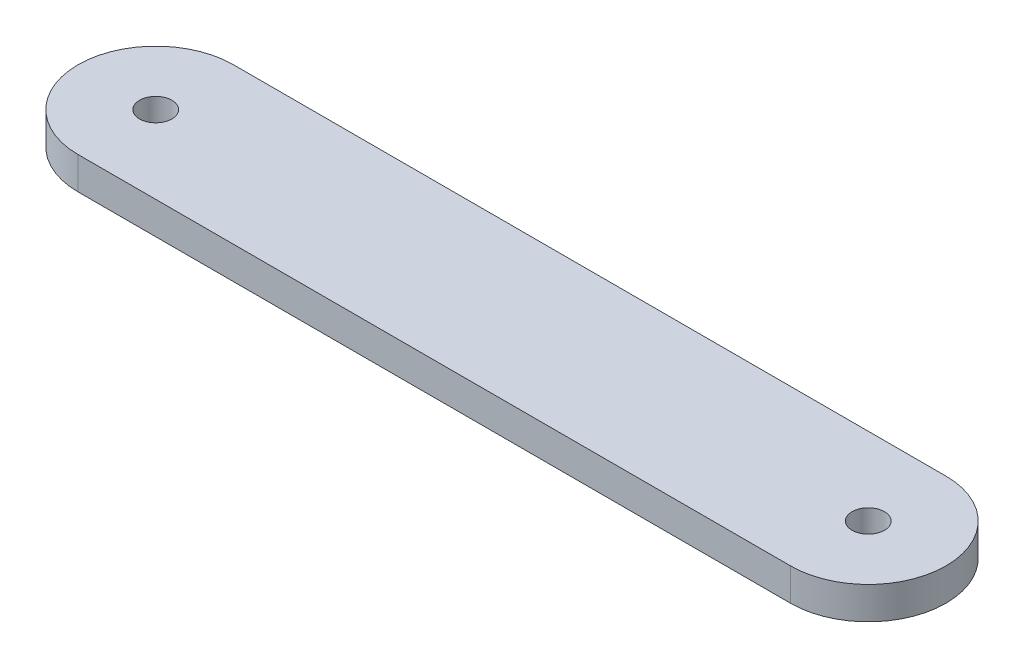
from build123d import *

# Parameters (mm, degrees)
SKETCH_1_R      = 2.5
EXTRUDE_1_DEPTH = 5


with BuildPart() as part:
    # Эскиз1 → Вытянуть1 (new body)
    with BuildSketch(Plane(origin=(0, 0, 0), x_dir=(1, 0, 0), z_dir=(0, 1, 0))):
        with BuildLine():
            Line((0, 10.177767955), (110, 10.177767955))
            ThreePointArc((110, 10.177767955), (122, -1.822232045), (110, -13.822232045))
            Line((110, -13.822232045), (0, -13.822232045))
            ThreePointArc((0, -13.822232045), (-12, -1.822232045), (0, 10.177767955))
        make_face()
        with Locations(Location((0, -1.822232045, 0), (0, 0, 270))):
            Circle(SKETCH_1_R, mode=Mode.SUBTRACT)
        with Locations(Location((110, -1.822232045, 0), (0, 0, 270))):
            Circle(SKETCH_1_R, mode=Mode.SUBTRACT)
    extrude(amount=EXTRUDE_1_DEPTH)


solid = part.part
